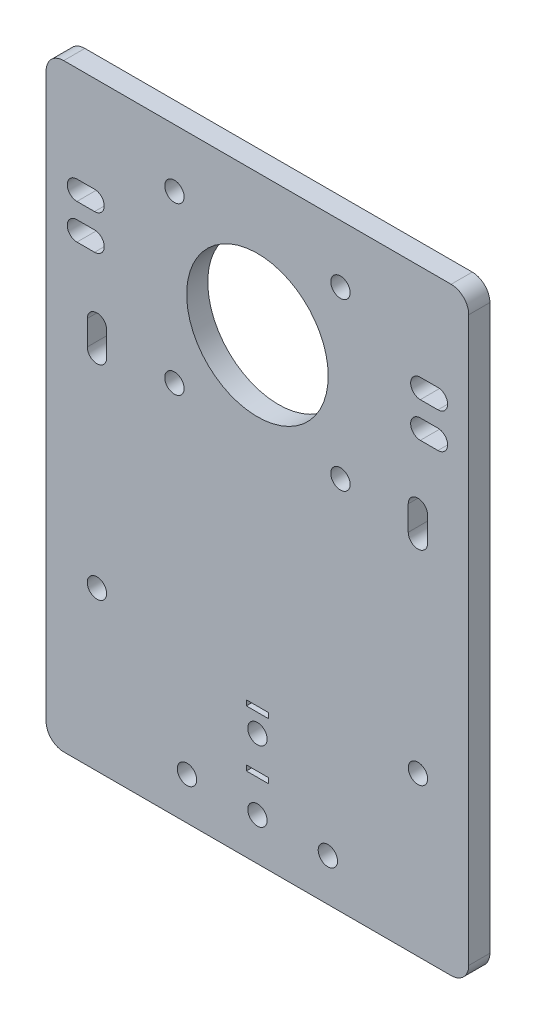
from build123d import *

# Parameters (mm, degrees)
BOSS_EXTRUDE1_DEPTH      = 6
SKETCH3_R                = 20.1
CUT_EXTRUDE1_DEPTH       = 6
M5_CLEARANCE_HOLE1_D     = 5.5
CUT_EXTRUDE2_DEPTH       = 6
CUT_EXTRUDE4_DEPTH       = 6
M5_CLEARANCE_HOLE3_D     = 5.5
M5_CLEARANCE_HOLE2_D     = 5.5
M5_CLEARANCE_HOLE2_DEPTH = 10
M5_CLEARANCE_HOLE2_TIP   = 1.652366702
SKETCH21_W               = 6.3
SKETCH21_H               = 1.5
CUT_EXTRUDE5_DEPTH       = 6
SKETCH22_W               = 6.3
SKETCH22_H               = 1.5
CUT_EXTRUDE6_DEPTH       = 10


with BuildPart() as part:
    # Sketch1 → Boss-Extrude1 (new body)
    with BuildSketch(Plane.XY):
        with BuildLine():
            Line((-55, -85), (55, -85))
            ThreePointArc((55, -85), (58.535533906, -83.535533906), (60, -80))
            Line((60, -80), (60, 80))
            ThreePointArc((60, 80), (58.535533906, 83.535533906), (55, 85))
            Line((55, 85), (-55, 85))
            ThreePointArc((-55, 85), (-58.535533906, 83.535533906), (-60, 80))
            Line((-60, 80), (-60, -80))
            ThreePointArc((-60, -80), (-58.535533906, -83.535533906), (-55, -85))
        make_face()
    extrude(amount=BOSS_EXTRUDE1_DEPTH)

    # Sketch3 → Cut-Extrude1 (cut)
    with BuildSketch(Plane.XY.offset(6)):
        with Locations((0, 45)):
            Circle(SKETCH3_R)
    extrude(amount=-CUT_EXTRUDE1_DEPTH, mode=Mode.SUBTRACT)

    # M5 Clearance Hole1 (through all)
    with Locations(Plane.XY.offset(6)):
        with Locations((-23.57, 68.57), (23.57, 68.57), (23.57, 21.43), (-23.57, 21.43)):
            Hole(M5_CLEARANCE_HOLE1_D / 2)

    # Sketch11 → Cut-Extrude2 (cut)
    with BuildSketch(Plane.XY.offset(6)):
        with BuildLine():
            Line((-42.82, 24.93), (-42.82, 17.93))
            ThreePointArc((-42.82, 17.93), (-45.57, 15.18), (-48.32, 17.93))
            Line((-48.32, 17.93), (-48.32, 24.93))
            ThreePointArc((-48.32, 24.93), (-45.57, 27.68), (-42.82, 24.93))
        make_face()
        with BuildLine():
            Line((42.82, 24.93), (42.82, 17.93))
            ThreePointArc((42.82, 17.93), (45.57, 15.18), (48.32, 17.93))
            Line((48.32, 17.93), (48.32, 24.93))
            ThreePointArc((48.32, 24.93), (45.57, 27.68), (42.82, 24.93))
        make_face()
    extrude(amount=-CUT_EXTRUDE2_DEPTH, mode=Mode.SUBTRACT)

    # Sketch15 → Cut-Extrude4 (cut)
    with BuildSketch(Plane.XY.offset(6)):
        with BuildLine():
            Line((-51.25, 47.75), (-46.25, 47.75))
            ThreePointArc((-46.25, 47.75), (-43.5, 45), (-46.25, 42.25))
            Line((-46.25, 42.25), (-51.25, 42.25))
            ThreePointArc((-51.25, 42.25), (-54, 45), (-51.25, 47.75))
        make_face()
        with BuildLine():
            Line((-51.25, 57.75), (-46.25, 57.75))
            ThreePointArc((-46.25, 57.75), (-43.5, 55), (-46.25, 52.25))
            Line((-46.25, 52.25), (-51.25, 52.25))
            ThreePointArc((-51.25, 52.25), (-54, 55), (-51.25, 57.75))
        make_face()
        with BuildLine():
            Line((51.25, 47.75), (46.25, 47.75))
            ThreePointArc((46.25, 47.75), (43.5, 45), (46.25, 42.25))
            Line((46.25, 42.25), (51.25, 42.25))
            ThreePointArc((51.25, 42.25), (54, 45), (51.25, 47.75))
        make_face()
        with BuildLine():
            Line((51.25, 57.75), (46.25, 57.75))
            ThreePointArc((46.25, 57.75), (43.5, 55), (46.25, 52.25))
            Line((46.25, 52.25), (51.25, 52.25))
            ThreePointArc((51.25, 52.25), (54, 55), (51.25, 57.75))
        make_face()
    extrude(amount=-CUT_EXTRUDE4_DEPTH, mode=Mode.SUBTRACT)

    # M5 Clearance Hole3 (through all)
    with Locations(Plane.XY.offset(6)):
        with Locations((-45.57, -39.97), (45.57, -39.97), (20, -73), (0, -73), (-20, -73)):
            Hole(M5_CLEARANCE_HOLE3_D / 2)

    # M5 Clearance Hole2
    with Locations(Plane(origin=(0, 0, 0), x_dir=(-1, 0, 0), z_dir=(0, 0, -1))):
        with Locations((0, -53)):
            Hole(M5_CLEARANCE_HOLE2_D / 2, depth=M5_CLEARANCE_HOLE2_DEPTH)
            with Locations((0, 0, -(M5_CLEARANCE_HOLE2_DEPTH + M5_CLEARANCE_HOLE2_TIP / 2))):  # 118° drill point
                Cone(0, M5_CLEARANCE_HOLE2_D / 2, M5_CLEARANCE_HOLE2_TIP, mode=Mode.SUBTRACT)

    # Sketch21 → Cut-Extrude5 (cut)
    with BuildSketch(Plane(origin=(0, 0, 0), x_dir=(-1, 0, 0), z_dir=(0, 0, -1))):
        with Locations((0, -47)):
            Rectangle(SKETCH21_W, SKETCH21_H)
    extrude(amount=-CUT_EXTRUDE5_DEPTH, mode=Mode.SUBTRACT)

    # Sketch22 → Cut-Extrude6 (cut)
    with BuildSketch(Plane.XY.offset(6)):
        with Locations((0, -63)):
            Rectangle(SKETCH22_W, SKETCH22_H)
    extrude(amount=-CUT_EXTRUDE6_DEPTH, mode=Mode.SUBTRACT)


solid = part.part
